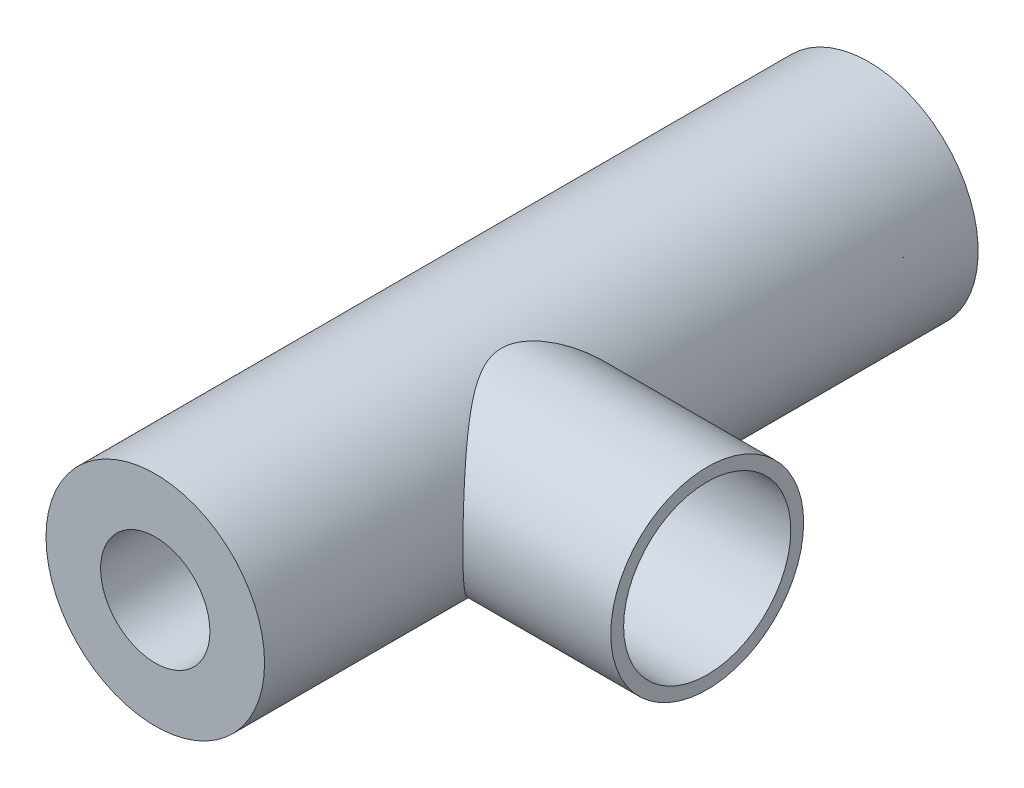
from build123d import *

# Parameters (mm, degrees)
SKETCH1_R           = 17
BOSS_EXTRUDE2_DEPTH = 40
SKETCH2_R           = 8.5
CUT_EXTRUDE1_DEPTH  = 38
CUT_EXTRUDE2_START  = -38
SKETCH3_R           = 8.5
CUT_EXTRUDE2_DEPTH  = 38
SKETCH4_R           = 15
SKETCH4_R_2         = 13
BOSS_EXTRUDE3_DEPTH = 40
CUT_EXTRUDE4_START  = -50
SKETCH6_R           = 8.5
CUT_EXTRUDE4_DEPTH  = 50
BOSS_EXTRUDE4_START = 45
SKETCH7_R           = 17
SKETCH7_R_2         = 8.5
BOSS_EXTRUDE4_DEPTH = 45
SKETCH8_R           = 17
SKETCH8_R_2         = 8.5
BOSS_EXTRUDE5_DEPTH = 26


with BuildPart() as part:
    # Sketch1 → Boss-Extrude2 (new body)
    with BuildSketch(Plane.XY):
        Circle(SKETCH1_R)
    extrude(amount=BOSS_EXTRUDE2_DEPTH)

    # Sketch2 → Cut-Extrude1 (cut)
    with BuildSketch(Plane.XY.offset(40)):
        Circle(SKETCH2_R)
    extrude(amount=-CUT_EXTRUDE1_DEPTH, mode=Mode.SUBTRACT)

    # Sketch3 → Cut-Extrude2 (cut)
    with BuildSketch(Plane(origin=(0, 0, 0), x_dir=(-1, 0, 0), z_dir=(0, 0, -1)).offset(CUT_EXTRUDE2_START)):
        with Locations(Location((0, 0, 0), (0, 0, 180))):
            Circle(SKETCH3_R)
    extrude(amount=CUT_EXTRUDE2_DEPTH, mode=Mode.SUBTRACT)

    # Sketch4 → Boss-Extrude3 (add)
    with BuildSketch(Plane(origin=(0, 0, 0), x_dir=(0, 0, -1), z_dir=(1, 0, 0))):
        with Locations((-20.148533522, 0)):
            Circle(SKETCH4_R)
        with Locations(Location((-20.148533522, 0, 0), (0, 0, 180))):
            Circle(SKETCH4_R_2, mode=Mode.SUBTRACT)
    extrude(amount=BOSS_EXTRUDE3_DEPTH)

    # Sketch6 → Cut-Extrude4 (cut)
    with BuildSketch(Plane(origin=(0, 0, 0), x_dir=(-1, 0, 0), z_dir=(0, 0, -1)).offset(CUT_EXTRUDE4_START)):
        with Locations(Location((0, 0, 0), (0, 0, 180))):
            Circle(SKETCH6_R)
    extrude(amount=CUT_EXTRUDE4_DEPTH, mode=Mode.SUBTRACT)

    # Sketch7 → Boss-Extrude4 (add)
    with BuildSketch(Plane(origin=(0, 0, 0), x_dir=(-1, 0, 0), z_dir=(0, 0, -1)).offset(BOSS_EXTRUDE4_START)):
        Circle(SKETCH7_R)
        with Locations(Location((0, 0, 0), (0, 0, 180))):
            Circle(SKETCH7_R_2, mode=Mode.SUBTRACT)
    extrude(amount=-BOSS_EXTRUDE4_DEPTH)

    # Sketch8 → Boss-Extrude5 (add)
    with BuildSketch(Plane.XY.offset(40)):
        with Locations(Location((0, 0, 0), (0, 0, 180))):
            Circle(SKETCH8_R)
        Circle(SKETCH8_R_2, mode=Mode.SUBTRACT)
    extrude(amount=BOSS_EXTRUDE5_DEPTH)


solid = part.part
